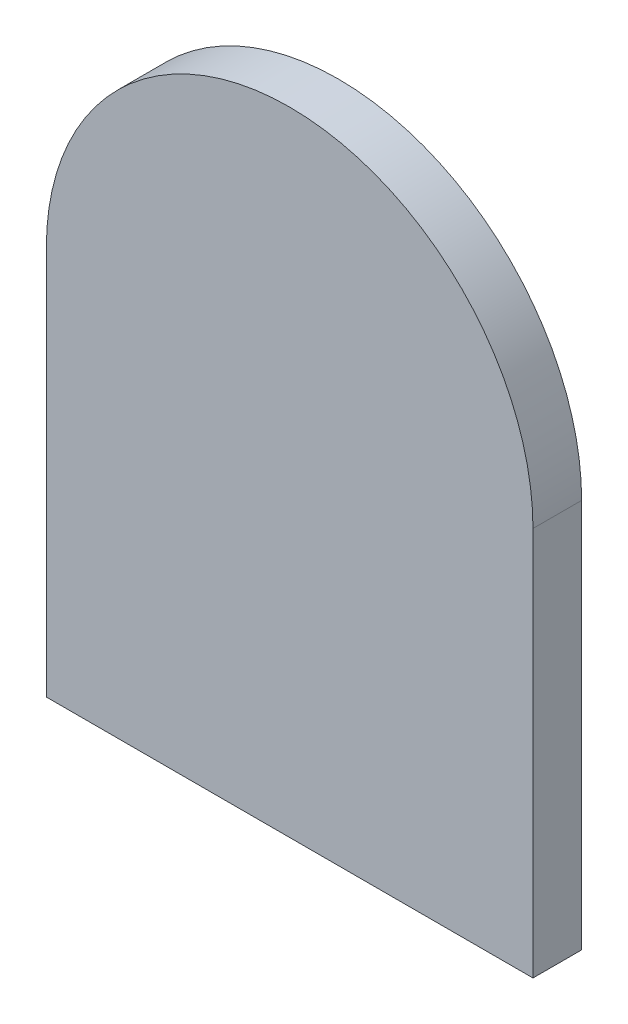
from build123d import *

# Parameters (mm, degrees)
BOSS_EXTRU_1_DEPTH = 5


with BuildPart() as part:
    # Esquisse1 → Boss.-Extru.1 (new body)
    with BuildSketch(Plane.XY):
        with BuildLine():
            ThreePointArc((25, 20), (0, 45), (-25, 20))
            Line((-25, 20), (-25, -20))
            Line((-25, -20), (25, -20))
            Line((25, -20), (25, 20))
        make_face()
    extrude(amount=BOSS_EXTRU_1_DEPTH)


solid = part.part
